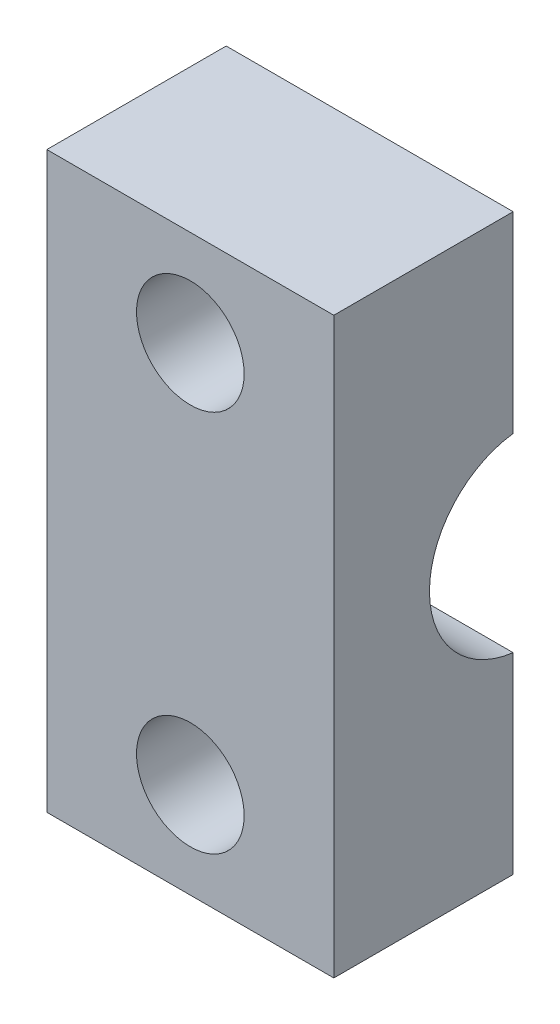
from build123d import *

# Parameters (mm, degrees)
BOSS_EXTRUDE1_DEPTH = 12
SKETCH2_R           = 2.25
CUT_EXTRUDE1_DEPTH  = 19.761663039
SKETCH3_W           = 12
SKETCH3_H           = 24
CUT_EXTRUDE2_DEPTH  = 0.5


with BuildPart() as part:
    # Sketch1 → Boss-Extrude1 (new body)
    with BuildSketch(Plane(origin=(0, 0, 0), x_dir=(0, 0, -1), z_dir=(1, 0, 0))):
        with BuildLine():
            Line((8, -4), (8, -12))
            Line((8, -12), (0, -12))
            Line((0, -12), (0, 12))
            Line((0, 12), (8, 12))
            Line((8, 12), (8, 4))
            ThreePointArc((8, 4), (4, 0), (8, -4))
        make_face()
    extrude(amount=BOSS_EXTRUDE1_DEPTH)

    # Sketch2 → Cut-Extrude1 (cut, through all)
    with BuildSketch(Plane.XY):
        with Locations((6, 8)):
            Circle(SKETCH2_R)
        with Locations((6, -8)):
            Circle(SKETCH2_R)
    extrude(amount=-CUT_EXTRUDE1_DEPTH, mode=Mode.SUBTRACT)

    # Sketch3 → Cut-Extrude2 (cut)
    with BuildSketch(Plane(origin=(0, 0, -8), x_dir=(-1, 0, 0), z_dir=(0, 0, -1))):
        with Locations((-6, 0)):
            Rectangle(SKETCH3_W, SKETCH3_H)
    extrude(amount=-CUT_EXTRUDE2_DEPTH, mode=Mode.SUBTRACT)


solid = part.part
